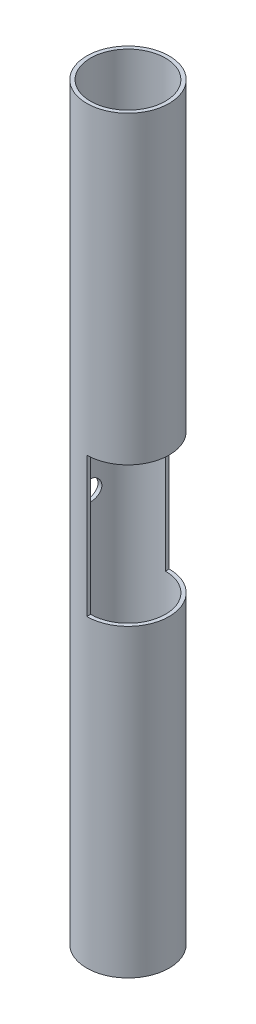
from build123d import *

# Parameters (mm, degrees)
SKETCH2_R           = 16.5
SKETCH2_R_2         = 15
BOSS_EXTRUDE1_DEPTH = 300
CUT_EXTRUDE1_DEPTH  = 28
SKETCH4_R           = 4
CUT_EXTRUDE2_DEPTH  = 30


with BuildPart() as part:
    # Sketch2 → Boss-Extrude1 (new body)
    with BuildSketch(Plane(origin=(0, 0, 0), x_dir=(1, 0, 0), z_dir=(0, 1, 0))):
        with Locations(Location((0, 0, 0), (0, 0, 270))):
            Circle(SKETCH2_R)
        with Locations(Location((0, 0, 0), (0, 0, 270))):
            Circle(SKETCH2_R_2, mode=Mode.SUBTRACT)
    extrude(amount=BOSS_EXTRUDE1_DEPTH)

    # Sketch3 → Cut-Extrude1 (cut)
    with BuildSketch(Plane(origin=(0, 0, 0), x_dir=(0, 0, -1), z_dir=(1, 0, 0))):
        Polygon((21.27756657, 178), (21.27756657, 122), (-16.5, 122), (-16.5, 150), (-16.5, 178), (-14, 178), align=None)
    extrude(amount=CUT_EXTRUDE1_DEPTH, mode=Mode.SUBTRACT)

    # Sketch4 → Cut-Extrude2 (cut)
    with BuildSketch(Plane(origin=(0, 0, 0), x_dir=(0, 0, -1), z_dir=(1, 0, 0))):
        with Locations((0, 150)):
            Circle(SKETCH4_R)
    extrude(amount=-CUT_EXTRUDE2_DEPTH, mode=Mode.SUBTRACT)


solid = part.part
